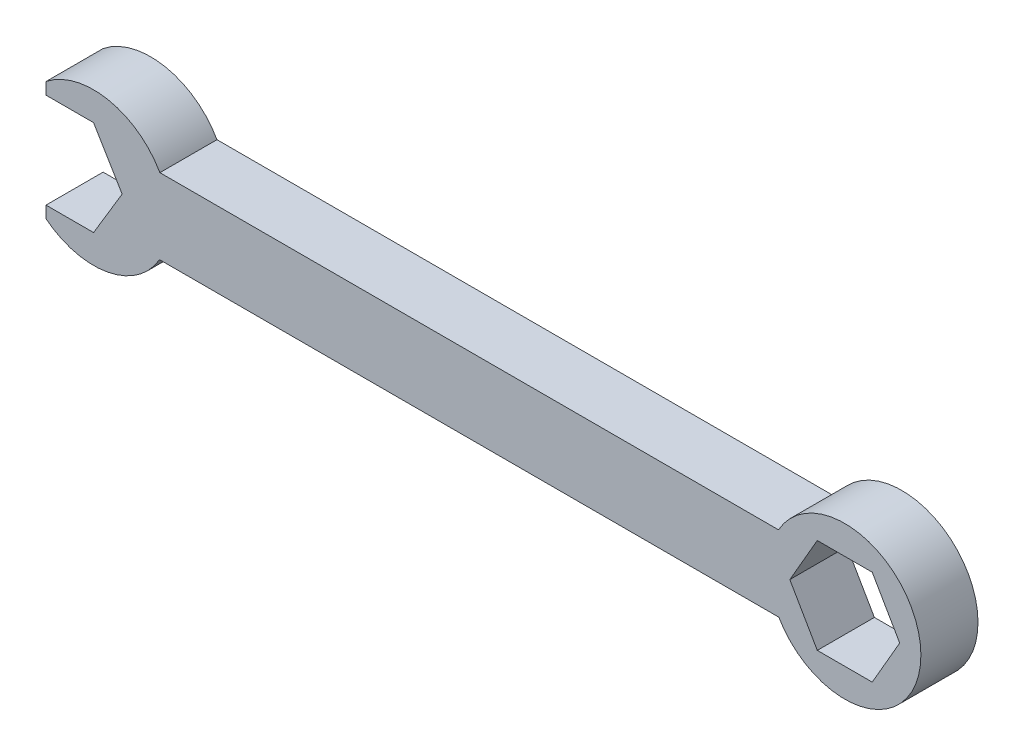
from build123d import *

# Parameters (mm, degrees)
BOSS_EXTRUDE2_DEPTH = 7.62


with BuildPart() as part:
    # Sketch1 → Boss-Extrude2 (new body)
    with BuildSketch(Plane.XY):
        with BuildLine():
            Line((8.798818102, -5.08), (91.44451632, -5.08))
            ThreePointArc((91.44451632, -5.08), (110.403219868, 0.048246477), (91.396667211, 4.996206486))
            Line((91.396667211, 4.996206486), (8.846667211, 4.996206486))
            ThreePointArc((8.846667211, 4.996206486), (1.926604894, 9.975660057), (-6.35, 7.931147458))
            Line((-6.35, 7.931147458), (-6.35, 6.35))
            Line((-6.35, 6.35), (0, 6.35))
            Line((0, 6.35), (3.81, 0))
            Line((3.81, 0), (0, -6.35))
            Line((0, -6.35), (-6.35, -6.35))
            Line((-6.35, -6.35), (-6.35, -7.931147458))
            ThreePointArc((-6.35, -7.931147458), (1.879212064, -9.984696391), (8.798818102, -5.08))
        make_face()
        Polygon((96.577160213, 6.35), (103.909508632, 6.35), (107.575682841, 0), (103.909508632, -6.35), (96.577160213, -6.35), (92.910986004, 0), align=None, mode=Mode.SUBTRACT)
    extrude(amount=BOSS_EXTRUDE2_DEPTH)


solid = part.part
